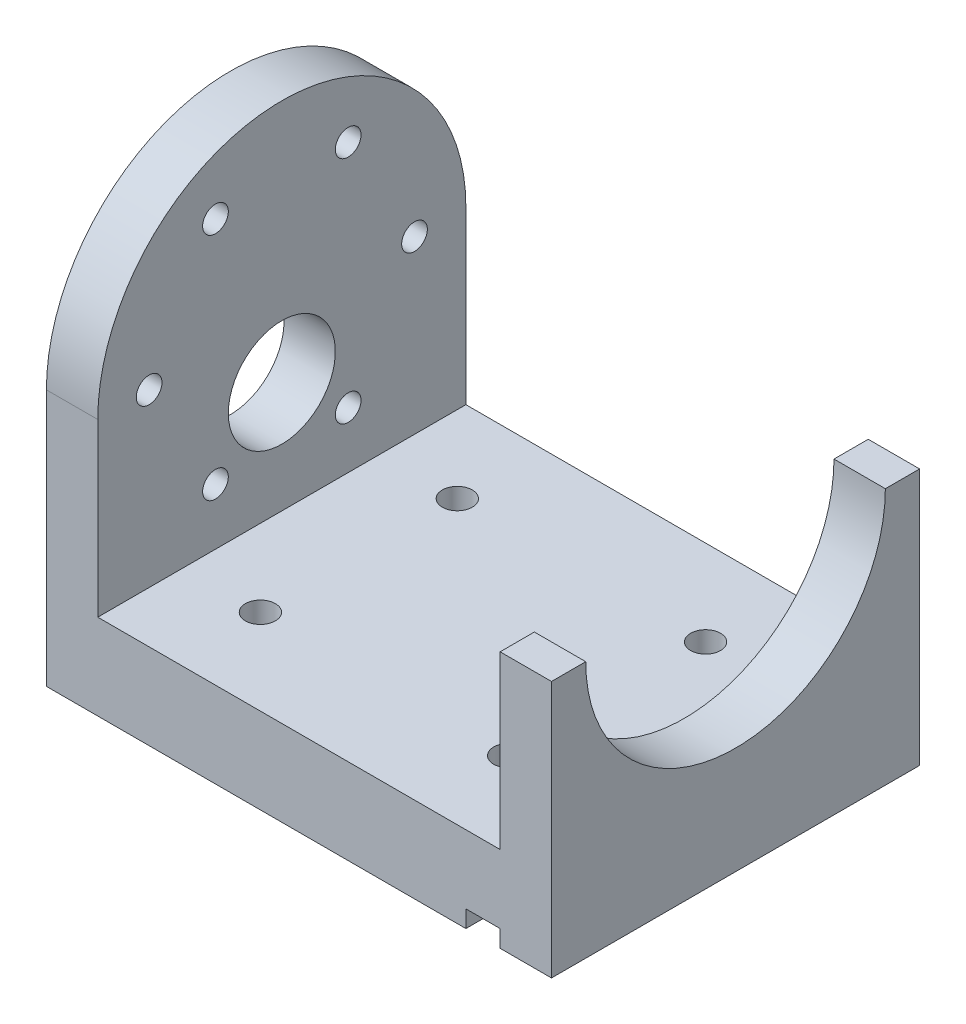
from build123d import *

# Parameters (mm, degrees)
SKETCH1_W           = 59
SKETCH1_H           = 43
SKETCH1_R           = 1.75
BOSS_EXTRUDE1_DEPTH = 10
SKETCH2_W           = 4
SKETCH2_H           = 43
CUT_EXTRUDE1_DEPTH  = 2
BOSS_EXTRUDE2_DEPTH = 6
SKETCH5_R           = 6.25
SKETCH5_R_2         = 1.5
BOSS_EXTRUDE3_DEPTH = 6


with BuildPart() as part:
    # Sketch1 → Boss-Extrude1 (new body)
    with BuildSketch(Plane(origin=(0, 0, 0), x_dir=(1, 0, 0), z_dir=(0, 1, 0))):
        with Locations((29.5, 21.5)):
            Rectangle(SKETCH1_W, SKETCH1_H)
        with Locations(Location((15, 33, 0), (0, 0, 270))):
            Circle(SKETCH1_R, mode=Mode.SUBTRACT)
        with Locations(Location((15, 10, 0), (0, 0, 90))):
            Circle(SKETCH1_R, mode=Mode.SUBTRACT)
        with Locations(Location((44, 33, 0), (0, 0, 90))):
            Circle(SKETCH1_R, mode=Mode.SUBTRACT)
        with Locations(Location((44, 10, 0), (0, 0, 270))):
            Circle(SKETCH1_R, mode=Mode.SUBTRACT)
    extrude(amount=BOSS_EXTRUDE1_DEPTH)

    # Sketch2 → Cut-Extrude1 (cut)
    with BuildSketch(Plane.XZ):
        with Locations((51, -21.5)):
            Rectangle(SKETCH2_W, SKETCH2_H)
    extrude(amount=-CUT_EXTRUDE1_DEPTH, mode=Mode.SUBTRACT)

    # Sketch3 → Boss-Extrude2 (add)
    with BuildSketch(Plane(origin=(59, 0, 0), x_dir=(0, 0, -1), z_dir=(1, 0, 0))):
        with BuildLine():
            Line((0, 10), (43, 10))
            Line((43, 10), (43, 30))
            Line((43, 30), (39, 30))
            ThreePointArc((39, 30), (21.5, 12.5), (4, 30))
            Line((4, 30), (0, 30))
            Line((0, 30), (0, 10))
        make_face()
    extrude(amount=-BOSS_EXTRUDE2_DEPTH)

    # Sketch5 → Boss-Extrude3 (add)
    with BuildSketch(Plane.ZY):
        with BuildLine():
            Line((-43, 10), (0, 10))
            Line((0, 10), (0, 30))
            ThreePointArc((0, 30), (-21.5, 51.5), (-43, 30))
            Line((-43, 30), (-43, 10))
        make_face()
        with Locations((-21.5, 23)):
            Circle(SKETCH5_R, mode=Mode.SUBTRACT)
        with Locations((-6, 30)):
            Circle(SKETCH5_R_2, mode=Mode.SUBTRACT)
        with Locations((-13.75, 16.576606241)):
            Circle(SKETCH5_R_2, mode=Mode.SUBTRACT)
        with Locations((-29.25, 16.576606241)):
            Circle(SKETCH5_R_2, mode=Mode.SUBTRACT)
        with Locations((-37, 30)):
            Circle(SKETCH5_R_2, mode=Mode.SUBTRACT)
        with Locations((-29.25, 43.423393759)):
            Circle(SKETCH5_R_2, mode=Mode.SUBTRACT)
        with Locations((-13.75, 43.423393759)):
            Circle(SKETCH5_R_2, mode=Mode.SUBTRACT)
    extrude(amount=-BOSS_EXTRUDE3_DEPTH)


solid = part.part
